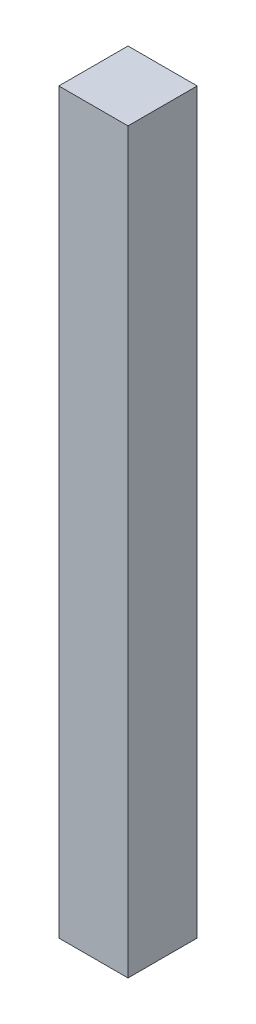
from build123d import *

# Parameters (mm, degrees)
SKETCH1_W           = 19.05
SKETCH1_H           = 203.2
BOSS_EXTRUDE1_DEPTH = 19.05


with BuildPart() as part:
    # Sketch1 → Boss-Extrude1 (new body)
    with BuildSketch(Plane.XY):
        with Locations((9.525, 101.6)):
            Rectangle(SKETCH1_W, SKETCH1_H)
    extrude(amount=BOSS_EXTRUDE1_DEPTH)


solid = part.part
